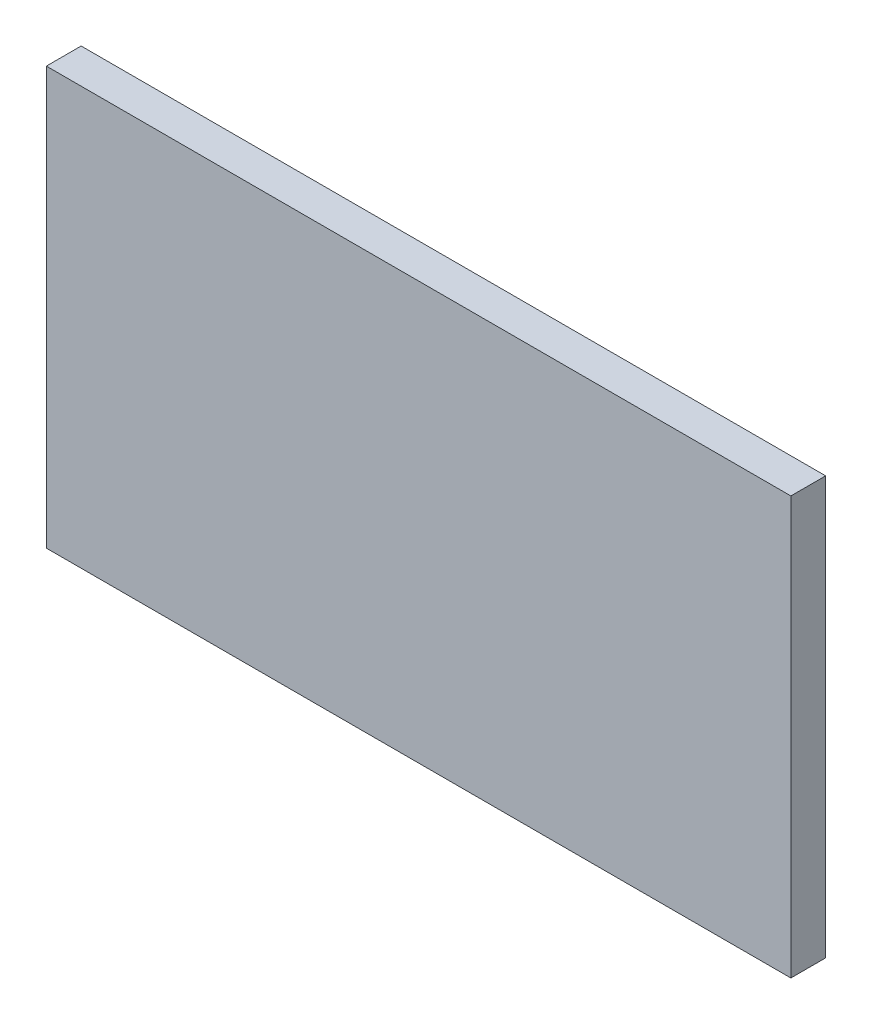
from build123d import *

# Parameters (mm, degrees)
SKETCH_1_W      = 214
SKETCH_1_H      = 120
EXTRUDE_1_DEPTH = 10


with BuildPart() as part:
    # 草图1 → 凸台-拉伸1 (new body)
    with BuildSketch(Plane.XY):
        Rectangle(SKETCH_1_W, SKETCH_1_H)
    extrude(amount=EXTRUDE_1_DEPTH)


solid = part.part
